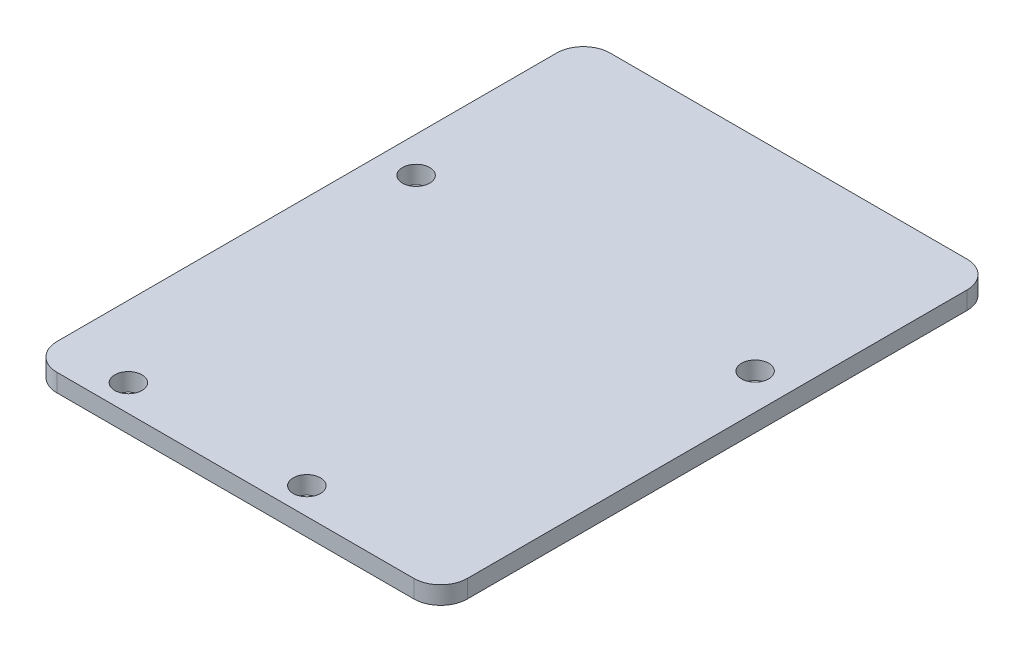
from build123d import *

# Parameters (mm, degrees)
SKETCH_1_W          = 46
SKETCH_1_H          = 62
EXTRUDE_1_DEPTH     = 2
SKETCH_2_R          = 1.525
CUT_EXTRUDE_1_DEPTH = 2
SKETCH_3_R          = 1.525
CUT_EXTRUDE_2_DEPTH = 2
FILLET_1_R          = 3


with BuildPart() as part:
    # 草图1 → 凸台-拉伸1 (new body)
    with BuildSketch(Plane(origin=(0, 0, 0), x_dir=(1, 0, 0), z_dir=(0, 1, 0))):
        Rectangle(SKETCH_1_W, SKETCH_1_H)
    extrude(amount=EXTRUDE_1_DEPTH)

    # 草图2 → 切除-拉伸1 (cut)
    with BuildSketch(Plane.XZ):
        with Locations(Location((19, -8.25, 0), (0, 0, 270))):
            Circle(SKETCH_2_R)
        with Locations(Location((-19, -8.25, 0), (0, 0, 270))):
            Circle(SKETCH_2_R)
    extrude(amount=-CUT_EXTRUDE_1_DEPTH, mode=Mode.SUBTRACT)

    # 草图3 → 切除-拉伸2 (cut)
    with BuildSketch(Plane.XZ):
        with Locations(Location((5, 28, 0), (0, 0, 270))):
            Circle(SKETCH_3_R)
        with Locations(Location((-15, 28, 0), (0, 0, 270))):
            Circle(SKETCH_3_R)
    extrude(amount=-CUT_EXTRUDE_2_DEPTH, mode=Mode.SUBTRACT)

    # 圆角1
    fillet_1_edges = [part.edges().sort_by_distance(p)[0] for p in [
        (23, 1, 31),
        (-23, 1, 31),
        (-23, 1, -31),
        (23, 1, -31),
    ]]
    fillet(fillet_1_edges, radius=FILLET_1_R)


solid = part.part
